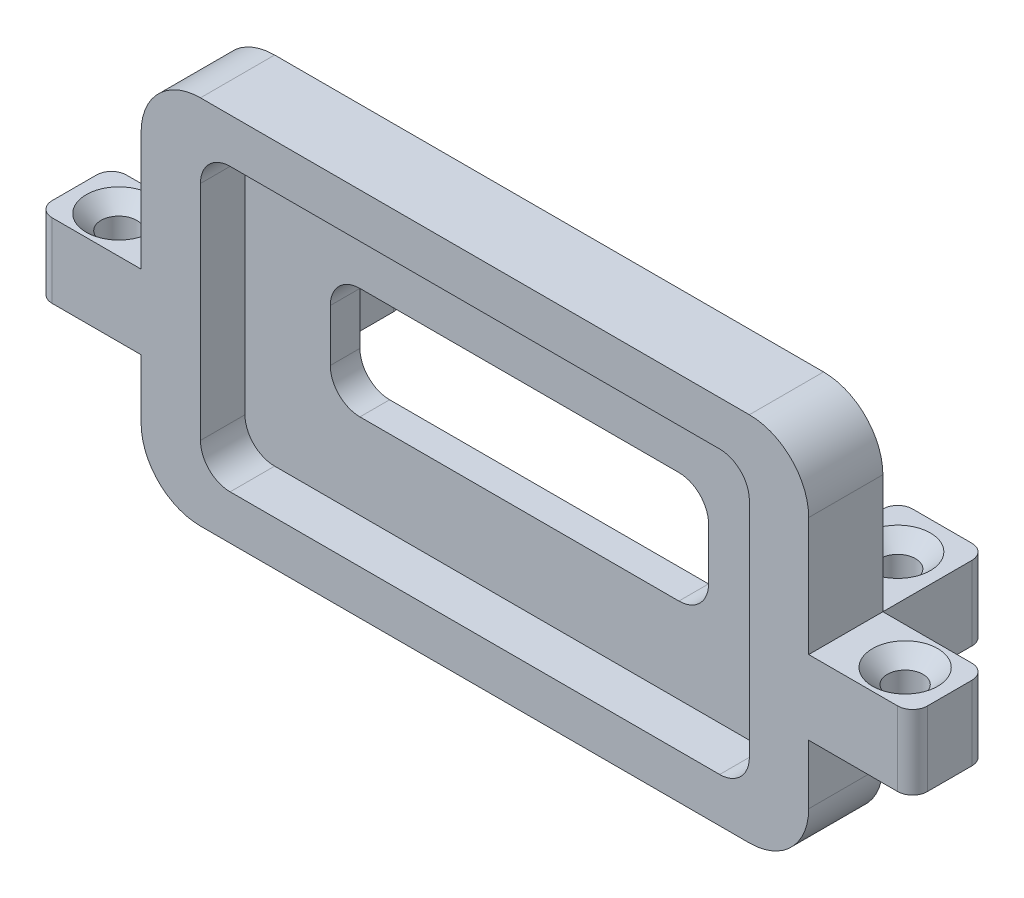
from build123d import *

# Parameters (mm, degrees)
SKETCH1_W                                       = 45
SKETCH1_H                                       = 25
BOSS_EXTRUDE1_DEPTH                             = 5
SKETCH2_W                                       = 37
SKETCH2_H                                       = 19
CUT_EXTRUDE1_DEPTH                              = 3
FILLET1_R                                       = 2
CUT_EXTRUDE2_DEPTH                              = 26.91331704
FILLET2_R                                       = 4
SKETCH4_W                                       = 5
SKETCH4_H                                       = 5
BOSS_EXTRUDE2_DEPTH                             = 7
CSK_FOR_M2_FLAT_HEAD_MACHINE_SCREW1_D           = 2.4
CSK_FOR_M2_FLAT_HEAD_MACHINE_SCREW1_CSINK_D     = 4.4
CSK_FOR_M2_FLAT_HEAD_MACHINE_SCREW1_CSINK_ANGLE = 90
FILLET3_R                                       = 1
FILLET3_OF_MIRROR1_R                            = 1
SKETCH8_W                                       = 6
SKETCH8_H                                       = 5
BOSS_EXTRUDE3_DEPTH                             = 7
CSK_FOR_M2_FLAT_HEAD_MACHINE_SCREW2_D           = 2.4
CSK_FOR_M2_FLAT_HEAD_MACHINE_SCREW2_CSINK_D     = 4.4
CSK_FOR_M2_FLAT_HEAD_MACHINE_SCREW2_CSINK_ANGLE = 90
FILLET4_R                                       = 1
FILLET4_OF_MIRROR2_R                            = 1


with BuildPart() as part:
    # Sketch1 → Boss-Extrude1 (new body)
    with BuildSketch(Plane.XY):
        Rectangle(SKETCH1_W, SKETCH1_H)
    extrude(amount=BOSS_EXTRUDE1_DEPTH)

    # Sketch2 → Cut-Extrude1 (cut)
    with BuildSketch(Plane.XY.offset(5)):
        Rectangle(SKETCH2_W, SKETCH2_H)
    extrude(amount=-CUT_EXTRUDE1_DEPTH, mode=Mode.SUBTRACT)

    # Fillet1
    fillet1_edges = [part.edges().sort_by_distance(p)[0] for p in [
        (18.5, 9.5, 3.5),
        (18.5, -9.5, 3.5),
        (-18.5, -9.5, 3.5),
        (-18.5, 9.5, 3.5),
    ]]
    fillet(fillet1_edges, radius=FILLET1_R)

    # Sketch3 → Cut-Extrude2 (cut, through all)
    with BuildSketch(Plane.XY.offset(2)):
        with BuildLine():
            Line((-10.75, -3.75), (10.75, -3.75))
            ThreePointArc((10.75, -3.75), (12.164213562, -3.164213562), (12.75, -1.75))
            Line((12.75, -1.75), (12.75, 1.75))
            ThreePointArc((12.75, 1.75), (12.164213562, 3.164213562), (10.75, 3.75))
            Line((10.75, 3.75), (-10.75, 3.75))
            ThreePointArc((-10.75, 3.75), (-12.164213562, 3.164213562), (-12.75, 1.75))
            Line((-12.75, 1.75), (-12.75, -1.75))
            ThreePointArc((-12.75, -1.75), (-12.164213562, -3.164213562), (-10.75, -3.75))
        make_face()
    extrude(amount=-CUT_EXTRUDE2_DEPTH, mode=Mode.SUBTRACT)

    # Fillet2
    fillet2_edges = [part.edges().sort_by_distance(p)[0] for p in [
        (22.5, -12.5, 2.5),
        (-22.5, -12.5, 2.5),
        (-22.5, 12.5, 2.5),
        (22.5, 12.5, 2.5),
    ]]
    fillet(fillet2_edges, radius=FILLET2_R)

    # Sketch4 → Boss-Extrude2 (add)
    with BuildSketch(Plane(origin=(22.5, 0, 0), x_dir=(0, 0, -1), z_dir=(1, 0, 0))):
        with Locations((-2.5, -2)):
            Rectangle(SKETCH4_W, SKETCH4_H)
    boss_extrude2 = extrude(amount=BOSS_EXTRUDE2_DEPTH)

    # CSK for M2 Flat Head Machine Screw1 (through all)
    with Locations(Plane(origin=(26.5, 0.5, 2.5), x_dir=(0, 0, 1), z_dir=(0, 1, 0))):
        with Locations((0, 0)):
            csk_for_m2_flat_head_machine_screw1 = CounterSinkHole(CSK_FOR_M2_FLAT_HEAD_MACHINE_SCREW1_D / 2, CSK_FOR_M2_FLAT_HEAD_MACHINE_SCREW1_CSINK_D / 2, counter_sink_angle=CSK_FOR_M2_FLAT_HEAD_MACHINE_SCREW1_CSINK_ANGLE)

    # Fillet3
    fillet3_edges = [part.edges().sort_by_distance(p)[0] for p in [
        (29.5, -2, 5),
        (29.5, -2, 0),
    ]]
    fillet(fillet3_edges, radius=FILLET3_R)

    # Mirror1: Boss-Extrude2, CSK for M2 Flat Head Machine Screw1 across plane
    add(boss_extrude2.mirror(Plane(origin=(0, 0, 0), x_dir=(0, 0, 1), z_dir=(1, 0, 0))))
    add(csk_for_m2_flat_head_machine_screw1.mirror(Plane(origin=(0, 0, 0), x_dir=(0, 0, 1), z_dir=(1, 0, 0))), mode=Mode.SUBTRACT)

    # Fillet3 of Mirror1
    fillet3_of_mirror1_edges = [part.edges().sort_by_distance(p)[0] for p in [
        (-29.5, -2, 5),
        (-29.5, -2, 0),
    ]]
    fillet(fillet3_of_mirror1_edges, radius=FILLET3_OF_MIRROR1_R)

    # Sketch8 → Boss-Extrude3 (add)
    with BuildSketch(Plane(origin=(0, 0, 0), x_dir=(-1, 0, 0), z_dir=(0, 0, -1))):
        with Locations((-19.5, -2)):
            Rectangle(SKETCH8_W, SKETCH8_H)
    boss_extrude3 = extrude(amount=BOSS_EXTRUDE3_DEPTH)

    # CSK for M2 Flat Head Machine Screw2 (through all)
    with Locations(Plane(origin=(19.5, 0.5, -4), x_dir=(0, 0, 1), z_dir=(0, 1, 0))):
        with Locations((0, 0)):
            csk_for_m2_flat_head_machine_screw2 = CounterSinkHole(CSK_FOR_M2_FLAT_HEAD_MACHINE_SCREW2_D / 2, CSK_FOR_M2_FLAT_HEAD_MACHINE_SCREW2_CSINK_D / 2, counter_sink_angle=CSK_FOR_M2_FLAT_HEAD_MACHINE_SCREW2_CSINK_ANGLE)

    # Fillet4
    fillet4_edges = [part.edges().sort_by_distance(p)[0] for p in [
        (22.5, -2, -7),
        (16.5, -2, -7),
    ]]
    fillet(fillet4_edges, radius=FILLET4_R)

    # Mirror2: Boss-Extrude3, CSK for M2 Flat Head Machine Screw2 across plane
    add(boss_extrude3.mirror(Plane(origin=(0, 0, 0), x_dir=(0, 0, 1), z_dir=(1, 0, 0))))
    add(csk_for_m2_flat_head_machine_screw2.mirror(Plane(origin=(0, 0, 0), x_dir=(0, 0, 1), z_dir=(1, 0, 0))), mode=Mode.SUBTRACT)

    # Fillet4 of Mirror2
    fillet4_of_mirror2_edges = [part.edges().sort_by_distance(p)[0] for p in [
        (-22.5, -2, -7),
        (-16.5, -2, -7),
    ]]
    fillet(fillet4_of_mirror2_edges, radius=FILLET4_OF_MIRROR2_R)


solid = part.part
